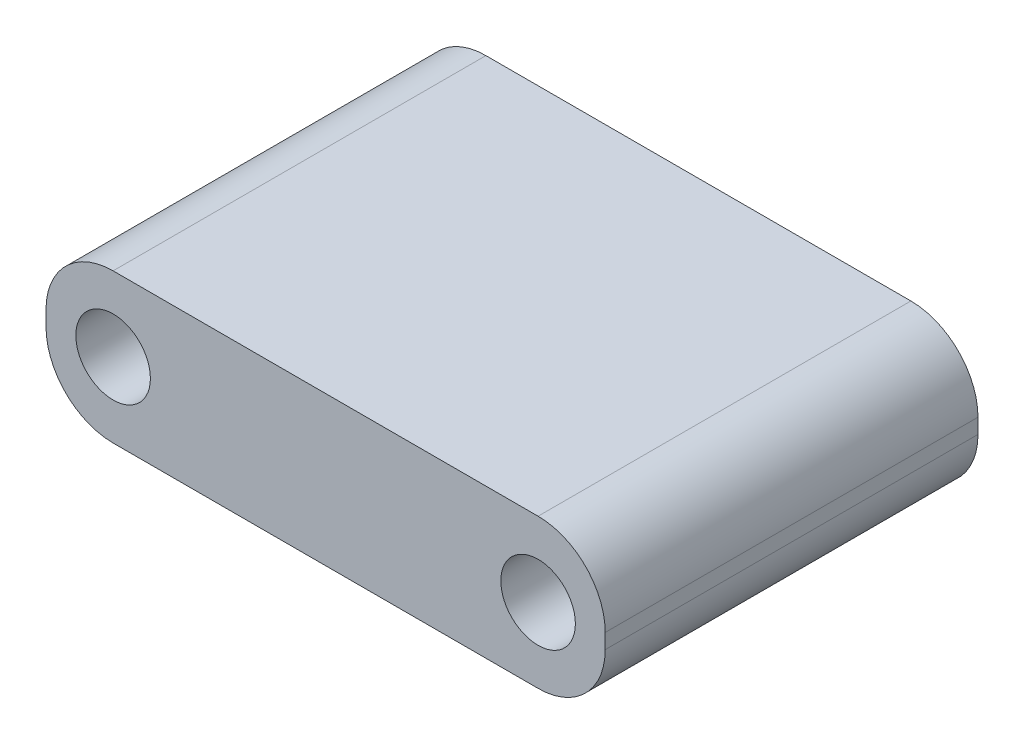
from build123d import *

# Parameters (mm, degrees)
SKETCH1_R           = 1
BOSS_EXTRUDE1_DEPTH = 10


with BuildPart() as part:
    # Sketch1 → Boss-Extrude1 (new body)
    with BuildSketch(Plane.XY):
        with BuildLine():
            Line((-61.437376587, 527.615636663), (-50.037376587, 527.615636663))
            ThreePointArc((-50.037376587, 527.615636663), (-48.764584381, 527.088428869), (-48.237376587, 525.815636663))
            Line((-48.237376587, 525.815636663), (-48.237376587, 525.415636663))
            ThreePointArc((-48.237376587, 525.415636663), (-48.764584381, 524.142844457), (-50.037376587, 523.615636663))
            Line((-50.037376587, 523.615636663), (-61.437376587, 523.615636663))
            ThreePointArc((-61.437376587, 523.615636663), (-62.710168793, 524.142844457), (-63.237376587, 525.415636663))
            Line((-63.237376587, 525.415636663), (-63.237376587, 525.815636663))
            ThreePointArc((-63.237376587, 525.815636663), (-62.710168793, 527.088428869), (-61.437376587, 527.615636663))
        make_face()
        with Locations((-61.437376587, 525.615636663)):
            Circle(SKETCH1_R, mode=Mode.SUBTRACT)
        with Locations((-50.037376587, 525.615636663)):
            Circle(SKETCH1_R, mode=Mode.SUBTRACT)
    extrude(amount=BOSS_EXTRUDE1_DEPTH)


solid = part.part
